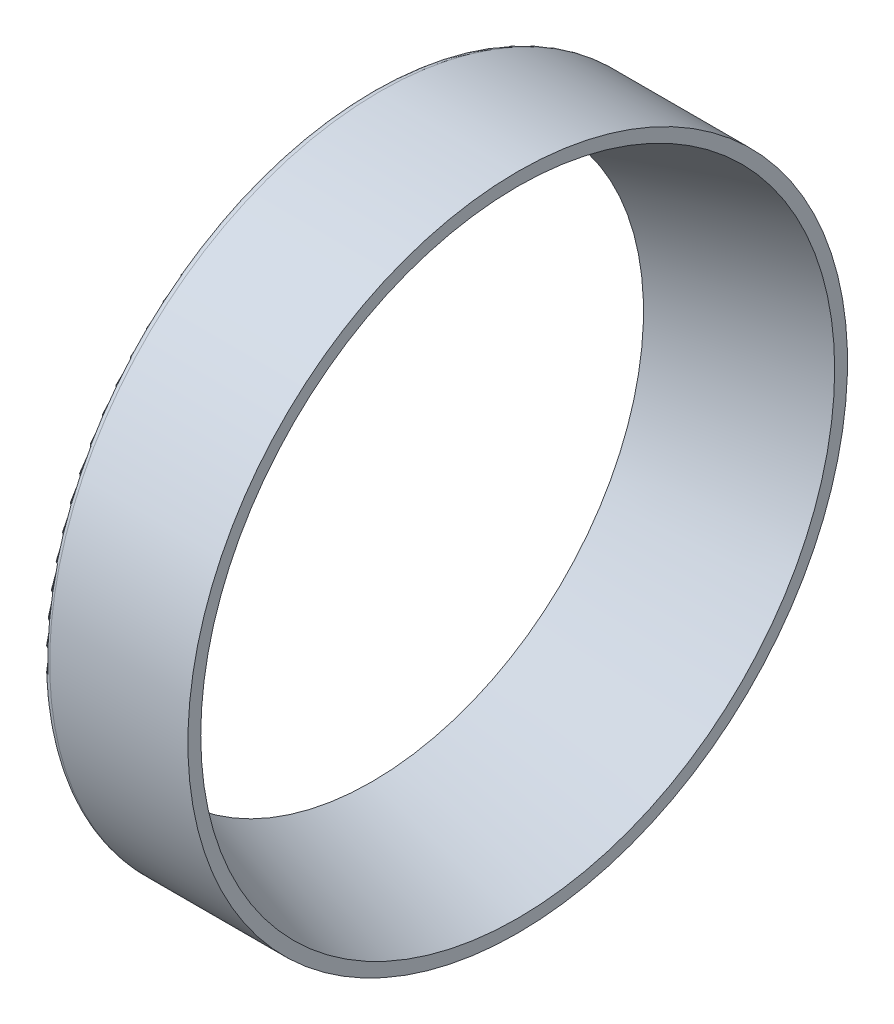
from build123d import *


with BuildPart() as part:
    # Esquisse1 → Base-Révolution (revolve)
    with BuildSketch(Plane.XY):
        with BuildLine():
            Line((-16.697119409, 22.9), (-16.697119409, 18.917261698))
            Line((-16.697119409, 18.917261698), (-5.197119409, 22.48794677))
            Line((-5.197119409, 22.48794677), (-5.197119409, 23.5))
            Line((-5.197119409, 23.5), (-16.097119409, 23.5))
            ThreePointArc((-16.097119409, 23.5), (-16.521383477, 23.324264069), (-16.697119409, 22.9))
        make_face()
    revolve(axis=Axis((0, -2.5, 0), (-1, 0, 0)))


solid = part.part
